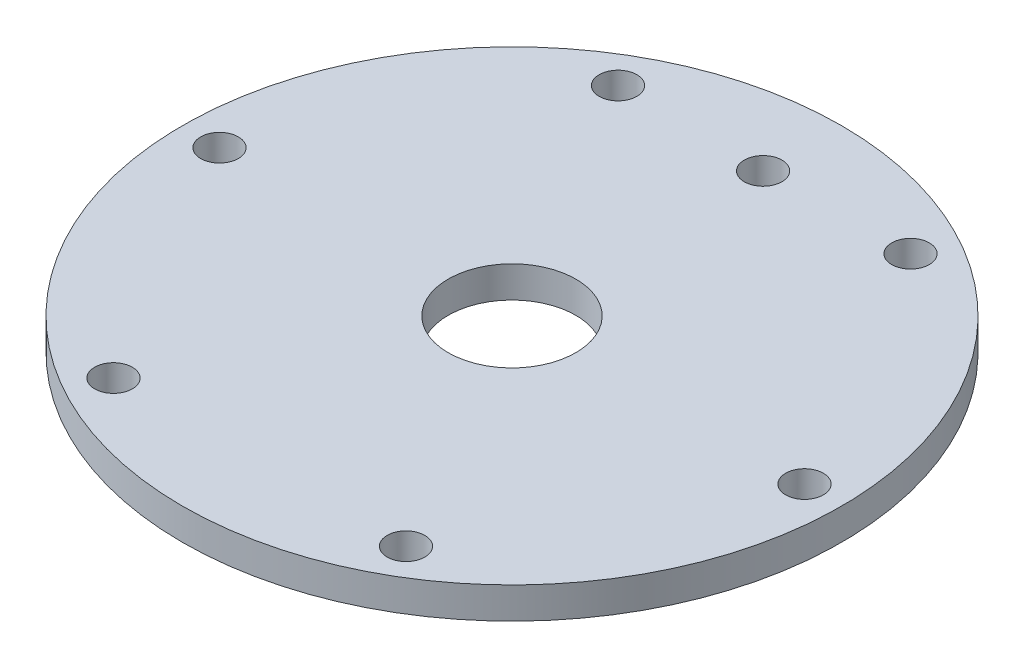
from build123d import *

# Parameters (mm, degrees)
SKETCH1_R           = 105
SKETCH1_R_2         = 20.325
BOSS_EXTRUDE1_DEPTH = 10
SKETCH2_R           = 6
CUT_EXTRUDE1_DEPTH  = 10
CIRPATTERN1_COUNT   = 6
SKETCH4_R           = 6
CUT_EXTRUDE2_DEPTH  = 10


with BuildPart() as part:
    # Sketch1 → Boss-Extrude1 (new body)
    with BuildSketch(Plane(origin=(0, 0, 0), x_dir=(1, 0, 0), z_dir=(0, 1, 0))):
        with Locations(Location((0, 0, 0), (0, 0, 270))):
            Circle(SKETCH1_R)
        with Locations(Location((0, 0, 0), (0, 0, 270))):
            Circle(SKETCH1_R_2, mode=Mode.SUBTRACT)
    extrude(amount=BOSS_EXTRUDE1_DEPTH)

    # Sketch2 → Cut-Extrude1 (cut)
    with BuildSketch(Plane(origin=(0, 10, 0), x_dir=(1, 0, 0), z_dir=(0, 1, 0))):
        with Locations(Location((93.00155101, 0.192929613, 0), (0, 0, 270))):
            Circle(SKETCH2_R)
        with Locations(Location((-46.333693559, -80.638170573, 0), (0, 0, 270))):
            Circle(SKETCH2_R)
        with Locations(Location((-46.667857451, 80.445240959, 0), (0, 0, 270))):
            Circle(SKETCH2_R)
    cut_extrude1 = extrude(amount=-CUT_EXTRUDE1_DEPTH, mode=Mode.SUBTRACT)

    # CirPattern1: Cut-Extrude1 ×6 about axis
    cirpattern1_axis = Axis((0, 0, 0), (0, 1, 0))
    for i in range(1, CIRPATTERN1_COUNT):
        add(cut_extrude1.rotate(cirpattern1_axis, i * 360 / CIRPATTERN1_COUNT), mode=Mode.SUBTRACT)

    # Sketch4 → Cut-Extrude2 (cut)
    with BuildSketch(Plane(origin=(0, 10, 0), x_dir=(1, 0, 0), z_dir=(0, 1, 0))):
        with Locations(Location((0, 80, 0), (0, 0, 270))):
            Circle(SKETCH4_R)
    extrude(amount=-CUT_EXTRUDE2_DEPTH, mode=Mode.SUBTRACT)


solid = part.part
